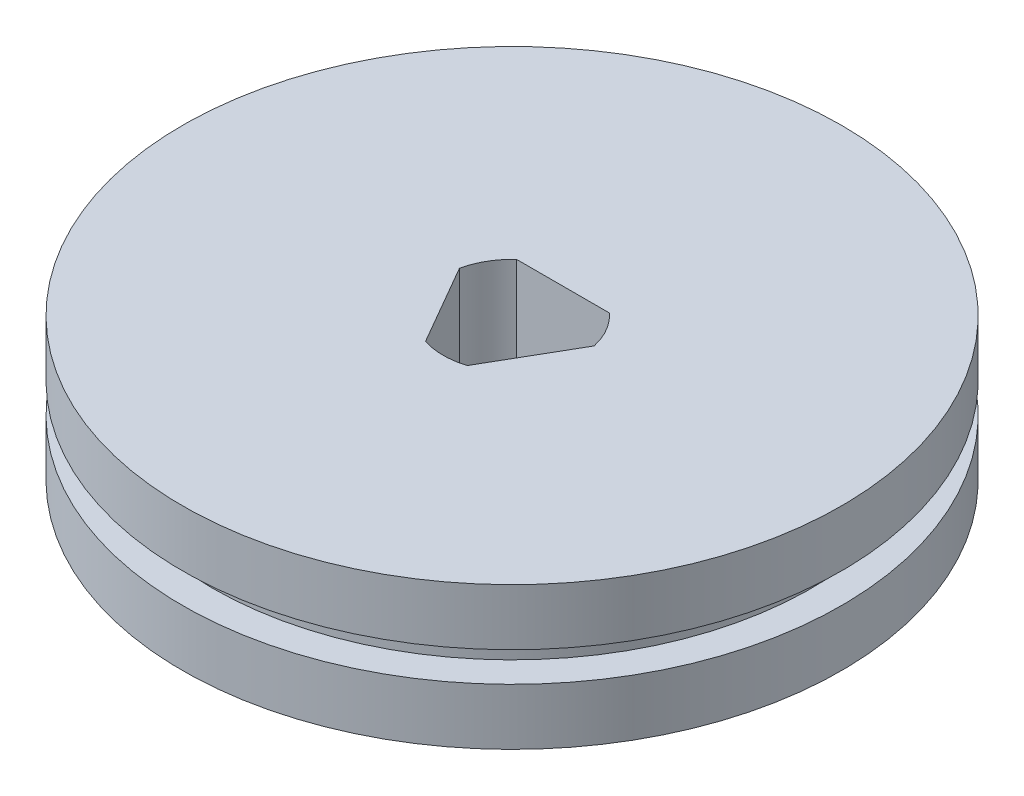
from build123d import *

# Parameters (mm, degrees)
ESBO_O1_R                = 11
RESSALTO_EXTRUS_O1_DEPTH = 2.38125
ESBO_O2_R                = 11
ESBO_O2_R_2              = 10
CORTE_EXTRUS_O1_DEPTH    = 0.5
CORTE_EXTRUS_O3_DEPTH    = 17.269032124


with BuildPart() as part:
    # Esboço1 → Ressalto-extrusão1 (new, symmetric)
    with BuildSketch(Plane(origin=(0, 0, 0), x_dir=(1, 0, 0), z_dir=(0, 1, 0))):
        with Locations(Location((0, 0, 0), (0, 0, 90))):
            Circle(ESBO_O1_R)
    extrude(amount=RESSALTO_EXTRUS_O1_DEPTH, both=True)

    # Esboço2 → Corte-extrusão1 (cut, symmetric)
    with BuildSketch(Plane(origin=(0, 0, 0), x_dir=(1, 0, 0), z_dir=(0, 1, 0))):
        with Locations(Location((0, 0, 0), (0, 0, 90))):
            Circle(ESBO_O2_R)
        with Locations(Location((0, 0, 0), (0, 0, 270))):
            Circle(ESBO_O2_R_2, mode=Mode.SUBTRACT)
    extrude(amount=CORTE_EXTRUS_O1_DEPTH, both=True, mode=Mode.SUBTRACT)

    # Esboço4 → Corte-extrusão3 (cut, through all)
    with BuildSketch(Plane(origin=(0, 2.38125, 0), x_dir=(1, 0, 0), z_dir=(0, 1, 0))):
        with BuildLine():
            Line((-2.246839856, 0.491640786), (-0.697646517, -2.191640786))
            ThreePointArc((-0.697646517, -2.191640786), (0, -2.3), (0.697646517, -2.191640786))
            Line((0.697646517, -2.191640786), (2.246839856, 0.491640786))
            ThreePointArc((2.246839856, 0.491640786), (1.991858429, 1.15), (1.549193338, 1.7))
            Line((1.549193338, 1.7), (-1.549193338, 1.7))
            ThreePointArc((-1.549193338, 1.7), (-1.991858429, 1.15), (-2.246839856, 0.491640786))
        make_face()
    extrude(amount=-CORTE_EXTRUS_O3_DEPTH, mode=Mode.SUBTRACT)


solid = part.part
